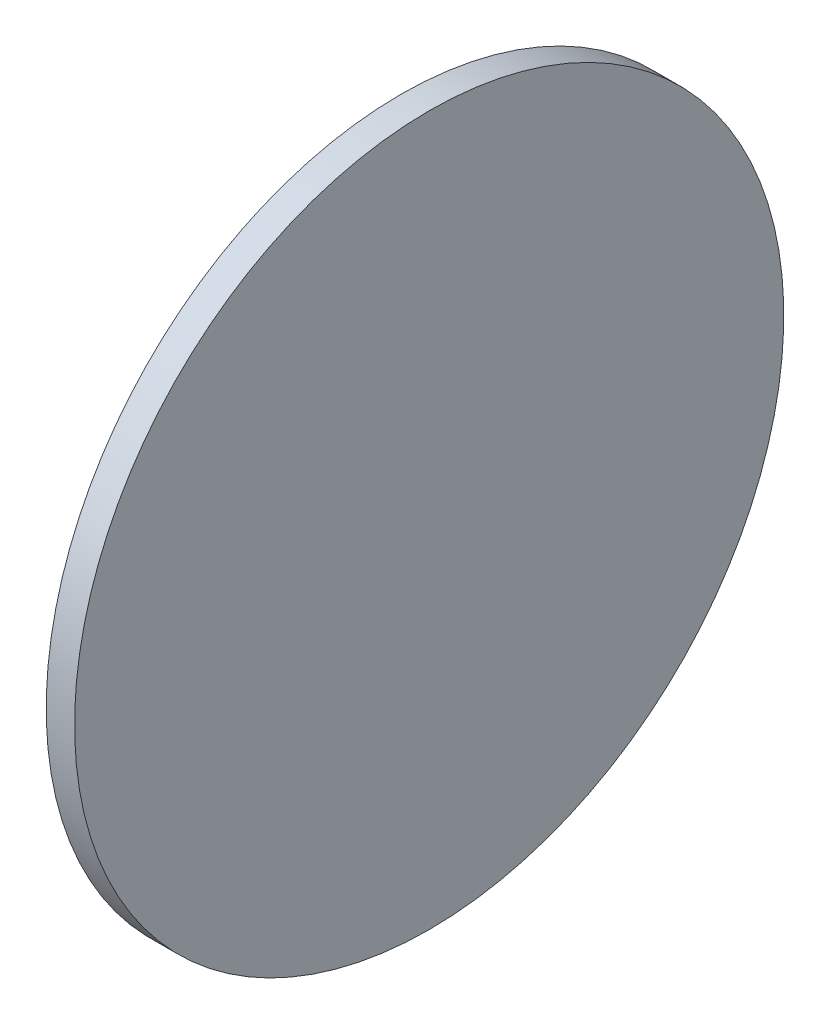
from build123d import *


with BuildPart() as part:
    # 草图1 → 旋转1 (revolve)
    with BuildSketch(Plane.XY):
        with BuildLine():
            Line((-9.5, 0), (0, 0))
            Line((0, 0), (0, 27.5))
            Line((0, 27.5), (-2.2, 27.5))
            ThreePointArc((-2.2, 27.5), (-7.643935033, 14.226208209), (-9.5, 0))
        make_face()
    revolve(axis=Axis((0, 0, 0), (-1, 0, 0)))


solid = part.part
